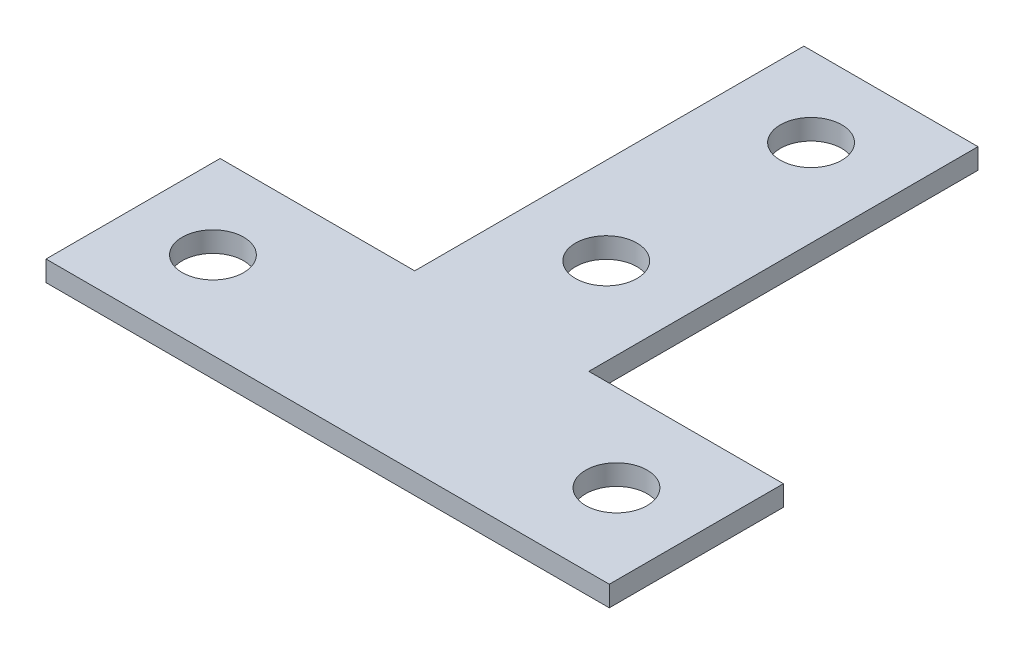
from build123d import *

# Parameters (mm, degrees)
SKETCH_1_W          = 55
SKETCH_1_H          = 55
EXTRUDE_1_DEPTH     = 2
SKETCH_2_W          = 19
SKETCH_2_H          = 38
CUT_EXTRUDE_1_DEPTH = 39.942264957
SKETCH_3_R          = 3
CUT_EXTRUDE_2_DEPTH = 39.942264957


with BuildPart() as part:
    # 草图1 → 凸台-拉伸1 (new body)
    with BuildSketch(Plane(origin=(0, 0, 0), x_dir=(1, 0, 0), z_dir=(0, 1, 0))):
        Rectangle(SKETCH_1_W, SKETCH_1_H)
    extrude(amount=EXTRUDE_1_DEPTH)

    # 草图2 → 切除-拉伸1 (cut, through all)
    with BuildSketch(Plane(origin=(0, 2, 0), x_dir=(1, 0, 0), z_dir=(0, 1, 0))):
        with Locations((-18, 8.5)):
            Rectangle(SKETCH_2_W, SKETCH_2_H)
        with Locations((18, 8.5)):
            Rectangle(SKETCH_2_W, SKETCH_2_H)
    extrude(amount=-CUT_EXTRUDE_1_DEPTH, mode=Mode.SUBTRACT)

    # 草图3 → 切除-拉伸2 (cut, through all)
    with BuildSketch(Plane(origin=(0, 2, 0), x_dir=(1, 0, 0), z_dir=(0, 1, 0))):
        with Locations(Location((-19.7, -19, 0), (0, 0, 270))):
            Circle(SKETCH_3_R)
        with Locations(Location((19.7, -19, 0), (0, 0, 270))):
            Circle(SKETCH_3_R)
        with Locations(Location((0, -0.3, 0), (0, 0, 270))):
            Circle(SKETCH_3_R)
        with Locations(Location((0, 19.7, 0), (0, 0, 270))):
            Circle(SKETCH_3_R)
    extrude(amount=-CUT_EXTRUDE_2_DEPTH, mode=Mode.SUBTRACT)


solid = part.part
